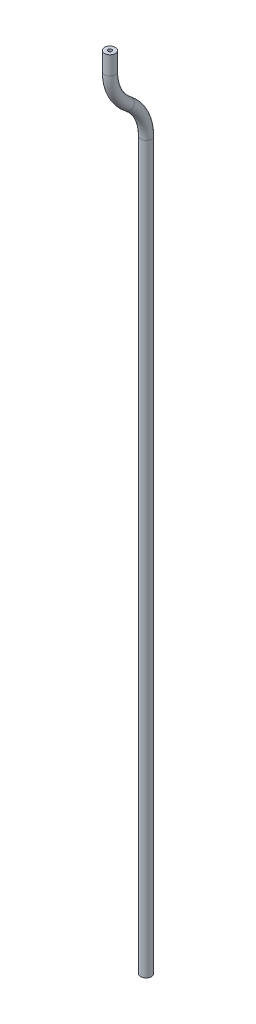
from build123d import *

# Parameters (mm, degrees)
UTILITY_CIRCULAR_CROSS_SECTION_R   = 1.75
UTILITY_CIRCULAR_CROSS_SECTION_R_2 = 0.6


with BuildPart() as part:
    # Native hollow utility sweep: sweep along a path in Illustrative smooth utility route
    with BuildLine(Plane(origin=(0, 0, 0), x_dir=(0, 0, -1), z_dir=(1, 0, 0))) as native_hollow_utility_sweep_path:
        Line((-16.25, 0), (-16.25, -6))
        ThreePointArc((-16.25, -6), (-14.702430847, -12.680486977), (-10.375, -18))
        ThreePointArc((-10.375, -18), (-6.047569153, -23.319513023), (-4.5, -30))
        Line((-4.5, -30), (-4.5, -266))
    # Utility circular cross section → Native hollow utility sweep (sweep)
    with BuildSketch(Plane(origin=(0, 0, 0), x_dir=(1, 0, 0), z_dir=(0, 1, 0))):
        with Locations((0, -16.25)):
            Circle(UTILITY_CIRCULAR_CROSS_SECTION_R)
        with Locations((0, -16.25)):
            Circle(UTILITY_CIRCULAR_CROSS_SECTION_R_2, mode=Mode.SUBTRACT)
    sweep(path=native_hollow_utility_sweep_path.line)


solid = part.part
